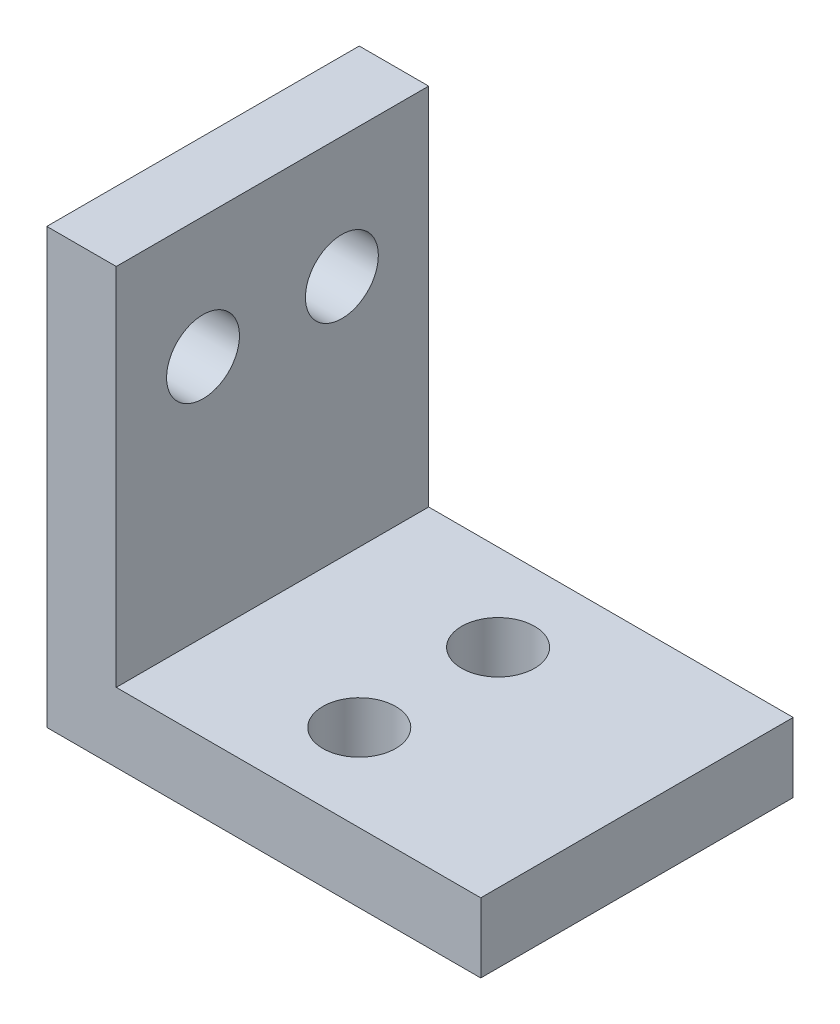
from build123d import *

# Parameters (mm, degrees)
EXTRUDE_1_DEPTH     = 18
SKETCH_4_R          = 2.1
CUT_EXTRUDE_3_DEPTH = 38
SKETCH_5_R          = 2.1
CUT_EXTRUDE_4_DEPTH = 38


with BuildPart() as part:
    # 草图1 → 凸台-拉伸1 (new body)
    with BuildSketch(Plane.XY):
        Polygon((0, 25), (0, 0), (25, 0), (25, 4), (4, 4), (4, 25), align=None)
    extrude(amount=EXTRUDE_1_DEPTH)

    # 草图4 → 切除-拉伸3 (cut)
    with BuildSketch(Plane(origin=(0, 4, 0), x_dir=(1, 0, 0), z_dir=(0, 1, 0))):
        with Locations(Location((13, -5, 0), (0, 0, 180))):
            Circle(SKETCH_4_R)
        with Locations(Location((13, -13, 0), (0, 0, 180))):
            Circle(SKETCH_4_R)
    extrude(amount=-CUT_EXTRUDE_3_DEPTH, mode=Mode.SUBTRACT)

    # 草图5 → 切除-拉伸4 (cut)
    with BuildSketch(Plane.ZY):
        with Locations(Location((5, 18, 0), (0, 0, 270))):
            Circle(SKETCH_5_R)
        with Locations(Location((13, 18, 0), (0, 0, 270))):
            Circle(SKETCH_5_R)
    extrude(amount=-CUT_EXTRUDE_4_DEPTH, mode=Mode.SUBTRACT)


solid = part.part
